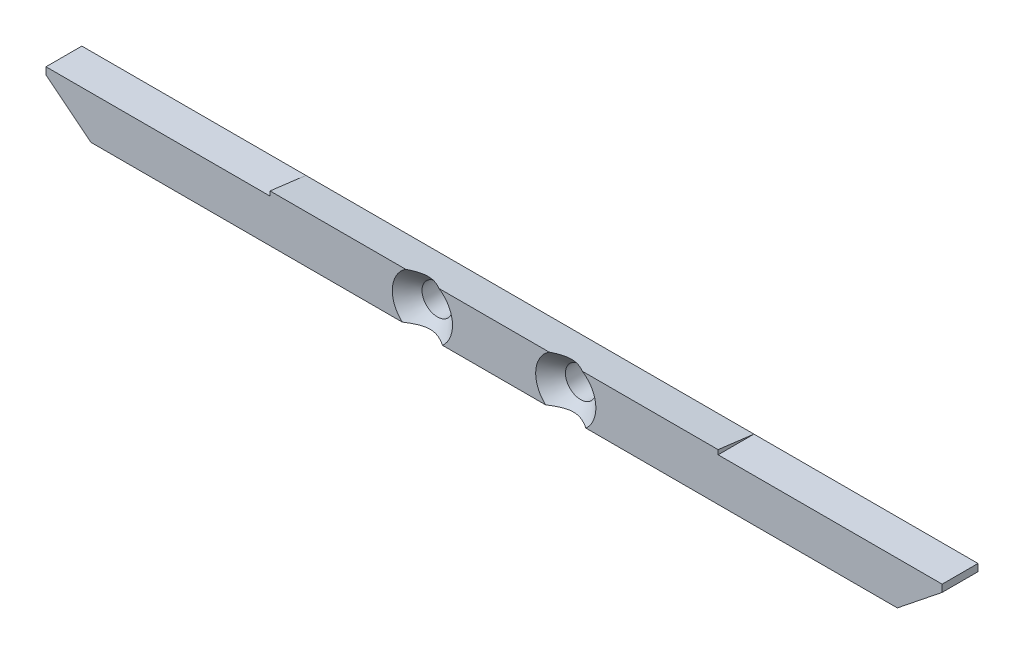
from build123d import *

# Parameters (mm, degrees)
SKETCH_1_W                   = 100
SKETCH_1_H                   = 5.3
EXTRUDE_1_DEPTH              = 4
CUT_EXTRUDE_1_DEPTH          = 101.220207543
SKETCH_3_R                   = 1.5
CUT_EXTRUDE_2_DEPTH          = 101.220207543
HOLE_WIZARD_M3_1_D           = 3.4
HOLE_WIZARD_M3_1_CSINK_D     = 6.72
HOLE_WIZARD_M3_1_CSINK_ANGLE = 90
CUT_EXTRUDE_3_DEPTH          = 101.220207543
CUT_EXTRUDE_4_DEPTH          = 25
CUT_EXTRUDE_5_DEPTH          = 25


with BuildPart() as part:
    # 草图1 → 凸台-拉伸1 (new body)
    with BuildSketch(Plane.XY):
        with Locations((50, 2.65)):
            Rectangle(SKETCH_1_W, SKETCH_1_H)
    extrude(amount=EXTRUDE_1_DEPTH)

    # 草图2 → 切除-拉伸1 (cut, through all)
    with BuildSketch(Plane(origin=(100, 0, 0), x_dir=(0, 0, -1), z_dir=(1, 0, 0))):
        Polygon((-4, 5.3), (0, 5.3), (0, 4.8), align=None)
    extrude(amount=-CUT_EXTRUDE_1_DEPTH, mode=Mode.SUBTRACT)

    # 草图3 → 切除-拉伸2 (cut, through all)
    with BuildSketch(Plane.XY.offset(4)):
        with Locations((42, 2.5)):
            Circle(SKETCH_3_R)
        with Locations(Location((58, 2.5, 0), (0, 0, 180))):
            Circle(SKETCH_3_R)
    extrude(amount=-CUT_EXTRUDE_2_DEPTH, mode=Mode.SUBTRACT)

    # M3 六角凹锥坑螺钉的锥形沉头孔1 (through all)
    with Locations(Plane(origin=(42, 2.5, 4), x_dir=(1, 0, 0), z_dir=(0, 0, 1))):
        with Locations((0, 0), (16, 0)):
            CounterSinkHole(HOLE_WIZARD_M3_1_D / 2, HOLE_WIZARD_M3_1_CSINK_D / 2, counter_sink_angle=HOLE_WIZARD_M3_1_CSINK_ANGLE)

    # 草图6 → 切除-拉伸3 (cut, through all)
    with BuildSketch(Plane.XY.offset(4)):
        Polygon((0, 4), (5, 0), (0, 0), align=None)
        Polygon((100, 0), (100, 4), (95, 0), align=None)
    extrude(amount=-CUT_EXTRUDE_3_DEPTH, mode=Mode.SUBTRACT)

    # 草图7 → 切除-拉伸4 (cut)
    with BuildSketch(Plane(origin=(100, 0, 0), x_dir=(0, 0, -1), z_dir=(1, 0, 0))):
        Polygon((-4, 5.3), (0, 4.8), (-4, 4.8), align=None)
    extrude(amount=-CUT_EXTRUDE_4_DEPTH, mode=Mode.SUBTRACT)

    # 草图8 → 切除-拉伸5 (cut)
    with BuildSketch(Plane.ZY):
        Polygon((0, 4.8), (4, 4.8), (4, 5.3), align=None)
    extrude(amount=-CUT_EXTRUDE_5_DEPTH, mode=Mode.SUBTRACT)


solid = part.part
